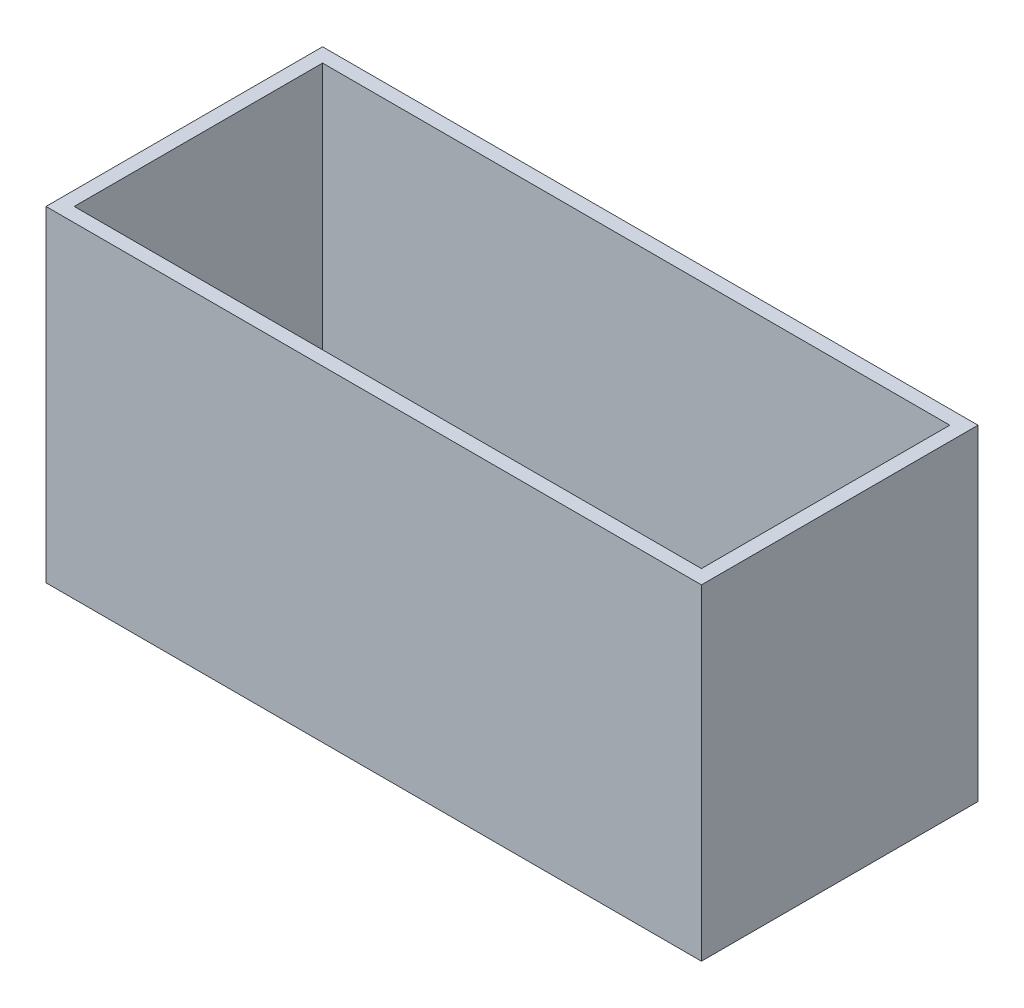
from build123d import *

# Parameters (mm, degrees)
SKETCH1_W          = 929
SKETCH1_H          = 392
BOTTOM_PLATE_DEPTH = 20
SKETCH2_W          = 929
SKETCH2_H          = 20
LEFT_WALL_DEPTH    = 462
SKETCH3_W          = 929
SKETCH3_H          = 20
RIGHT_WALL_DEPTH   = 462
SKETCH4_W          = 20
SKETCH4_H          = 352
BACK_WALL_DEPTH    = 462
SKETCH5_W          = 20
SKETCH5_H          = 352
FRONT_WALL_DEPTH   = 462


with BuildPart() as part:
    # Sketch1 → Bottom Plate (new body)
    with BuildSketch(Plane(origin=(0, 0, 0), x_dir=(1, 0, 0), z_dir=(0, 1, 0))):
        Rectangle(SKETCH1_W, SKETCH1_H)
    extrude(amount=BOTTOM_PLATE_DEPTH)

    # Sketch2 → Left Wall (add)
    with BuildSketch(Plane(origin=(0, 0, 0), x_dir=(1, 0, 0), z_dir=(0, 1, 0))):
        with Locations((0, 186)):
            Rectangle(SKETCH2_W, SKETCH2_H)
    extrude(amount=LEFT_WALL_DEPTH)

    # Sketch3 → Right Wall (add)
    with BuildSketch(Plane(origin=(0, 0, 0), x_dir=(1, 0, 0), z_dir=(0, 1, 0))):
        with Locations((0, -186)):
            Rectangle(SKETCH3_W, SKETCH3_H)
    extrude(amount=RIGHT_WALL_DEPTH)

    # Sketch4 → Back Wall (add)
    with BuildSketch(Plane(origin=(0, 0, 0), x_dir=(1, 0, 0), z_dir=(0, 1, 0))):
        with Locations((454.5, 0)):
            Rectangle(SKETCH4_W, SKETCH4_H)
    extrude(amount=BACK_WALL_DEPTH)

    # Sketch5 → Front Wall (add)
    with BuildSketch(Plane(origin=(0, 0, 0), x_dir=(1, 0, 0), z_dir=(0, 1, 0))):
        with Locations((-454.5, 0)):
            Rectangle(SKETCH5_W, SKETCH5_H)
    extrude(amount=FRONT_WALL_DEPTH)


solid = part.part
